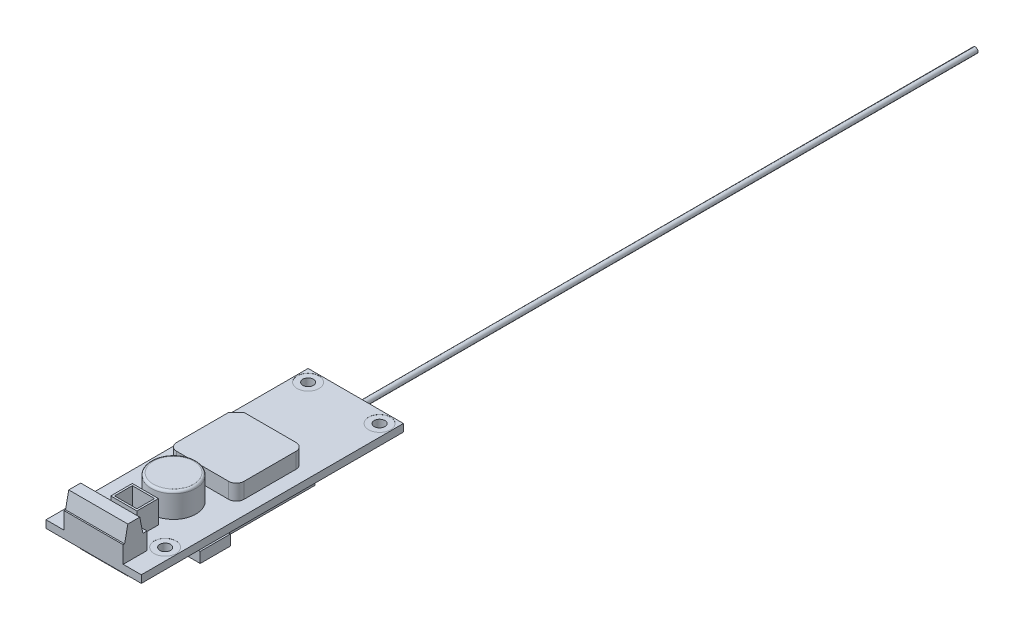
from build123d import *

# Parameters (mm, degrees)
SKETCH1_W                = 25.4
SKETCH1_H                = 69.85
BOARDOUTLINE_DEPTH       = 2
SKETCH2_R                = 1.4224
SCREWHOLES_DEPTH         = 2
SKETCH7_R                = 2.921
SCREWPADS_DEPTH          = 0.0254
ANTENNA_DEPTH            = 165.1
ANTENNA_DEPTH_BACK       = 5
SKETCH3_R                = 0.7239
SKETCH4_W                = 15.748
SKETCH4_H                = 6.35
BOSS_EXTRUDE3_DEPTH      = 4.5212
SKETCH5_W                = 17.9451
SKETCH5_H                = 17.9451
GPS_MAINBOX_DEPTH        = 4.1656
FILLET1_R                = 2.032
CHAMFER1_SIZE            = 2.032
SKETCH6_R                = 5.9817
BUZZER_BOX_DEPTH         = 6.5786
FILLET2_R                = 0.635
SKETCH8_W                = 6.9596
SKETCH8_H                = 5.7404
SKETCH8_W_2              = 5.9436
SKETCH8_H_2              = 4.7244
BATTERYTERMINAL_DEPTH    = 6.096
BACKSIDECOMPONENTS_DEPTH = 2.794


with BuildPart() as part:
    # Sketch1 → boardOutline (new body)
    with BuildSketch(Plane(origin=(0, 0, 0), x_dir=(1, 0, 0), z_dir=(0, 1, 0))):
        with Locations((12.7, 34.925)):
            Rectangle(SKETCH1_W, SKETCH1_H)
    extrude(amount=BOARDOUTLINE_DEPTH)

    # Sketch2 → screwHoles (cut)
    with BuildSketch(Plane(origin=(0, 2, 0), x_dir=(1, 0, 0), z_dir=(0, 1, 0))):
        with Locations(Location((3.175, 66.675, 0), (0, 0, 270))):
            Circle(SKETCH2_R)
        with Locations(Location((22.225, 66.675, 0), (0, 0, 270))):
            Circle(SKETCH2_R)
        with Locations(Location((3.175, 9.525, 0), (0, 0, 270))):
            Circle(SKETCH2_R)
        with Locations(Location((22.225, 9.525, 0), (0, 0, 270))):
            Circle(SKETCH2_R)
    extrude(amount=-SCREWHOLES_DEPTH, mode=Mode.SUBTRACT)

    # Sketch7 → screwPads (cut)
    with BuildSketch(Plane(origin=(0, 2, 0), x_dir=(1, 0, 0), z_dir=(0, 1, 0))):
        with Locations(Location((3.175, 9.525, 0), (0, 0, 270))):
            Circle(SKETCH7_R)
        with Locations(Location((22.225, 9.525, 0), (0, 0, 270))):
            Circle(SKETCH7_R)
        with Locations(Location((3.175, 66.675, 0), (0, 0, 270))):
            Circle(SKETCH7_R)
        with Locations(Location((22.225, 66.675, 0), (0, 0, 270))):
            Circle(SKETCH7_R)
    extrude(amount=-SCREWPADS_DEPTH, mode=Mode.SUBTRACT)

    # Sketch4 → Boss-Extrude3 (add)
    with BuildSketch(Plane(origin=(0, 2, 0), x_dir=(1, 0, 0), z_dir=(0, 1, 0))):
        with Locations((12.7, 3.175)):
            Rectangle(SKETCH4_W, SKETCH4_H)
    extrude(amount=BOSS_EXTRUDE3_DEPTH)

    # Sketch10 → Loft1 section 0
    with BuildSketch(Plane(origin=(0, 6.5212, 0), x_dir=(1, 0, 0), z_dir=(0, 1, 0))):
        with BuildLine():
            Line((4.826, 0.381), (20.574, 0.381))
            Line((20.574, 0.381), (20.574, 5.2578))
            Line((20.574, 5.2578), (4.826, 5.2578))
            Line((4.826, 5.2578), (4.826, 0.381))
        make_face()
    # Sketch11 → Loft1 section 1
    with BuildSketch(Plane(origin=(0, 10.6868, 0), x_dir=(1, 0, 0), z_dir=(0, 1, 0))):
        with BuildLine():
            Line((4.826, 1.2319), (20.574, 1.2319))
            Line((20.574, 1.2319), (20.574, 4.4069))
            Line((20.574, 4.4069), (4.826, 4.4069))
            Line((4.826, 4.4069), (4.826, 1.2319))
        make_face()
    loft()

    # Sketch5 → GPS_mainbox (add)
    with BuildSketch(Plane(origin=(0, 2, 0), x_dir=(1, 0, 0), z_dir=(0, 1, 0))):
        with Locations((12.7, 38.01745)):
            Rectangle(SKETCH5_W, SKETCH5_H)
    extrude(amount=GPS_MAINBOX_DEPTH)

    # Fillet1
    fillet1_edges = [part.edges().sort_by_distance(p)[0] for p in [
        (3.72745, 4.0828, -29.0449),
        (21.67255, 4.0828, -29.0449),
        (21.67255, 4.0828, -46.99),
    ]]
    fillet(fillet1_edges, radius=FILLET1_R)

    # Chamfer1
    chamfer1_edges = [part.edges().sort_by_distance(p)[0] for p in [
        (3.72745, 4.0828, -46.99),
    ]]
    chamfer(chamfer1_edges, length=CHAMFER1_SIZE)

    # Sketch6 → buzzer_box (add)
    with BuildSketch(Plane(origin=(0, 2, 0), x_dir=(1, 0, 0), z_dir=(0, 1, 0))):
        with Locations(Location((12.7, 21.2852, 0), (0, 0, 90))):
            Circle(SKETCH6_R)
    extrude(amount=BUZZER_BOX_DEPTH)

    # Fillet2
    fillet2_edges = [part.edges().sort_by_distance(p)[0] for p in [
        (12.7, 8.5786, -15.3035),
    ]]
    fillet(fillet2_edges, radius=FILLET2_R)

    # Sketch8 → batteryTerminal (add)
    with BuildSketch(Plane(origin=(0, 2, 0), x_dir=(1, 0, 0), z_dir=(0, 1, 0))):
        with Locations((12.7, 10.9093)):
            Rectangle(SKETCH8_W, SKETCH8_H)
        with Locations((12.7, 10.9093)):
            Rectangle(SKETCH8_W_2, SKETCH8_H_2, mode=Mode.SUBTRACT)
    extrude(amount=BATTERYTERMINAL_DEPTH)


with BuildPart() as body_2:
    # Sketch3 → antenna (new, two sides: drawn at the far end of the back side and taken through both)
    with BuildSketch(Plane(origin=(0, 0, -69.85), x_dir=(-1, 0, 0), z_dir=(0, 0, -1)).offset(-ANTENNA_DEPTH_BACK)):
        with Locations((-12.7, -0.7239)):
            Circle(SKETCH3_R)
    extrude(amount=ANTENNA_DEPTH + ANTENNA_DEPTH_BACK)


with BuildPart() as body_3:
    # Sketch12 → backsideComponents (new body)
    with BuildSketch(Plane.XZ):
        Polygon((0.8128, -15.24), (0.8128, -48.6156), (23.114, -48.6156), (23.114, -23.2918), (25.8572, -23.2918), (25.8572, -15.24), (19.05, -15.24), (19.05, -2.6924), (6.35, -2.6924), (6.35, -15.24), align=None)
    extrude(amount=BACKSIDECOMPONENTS_DEPTH)


solid = Compound([part.part, body_2.part, body_3.part])
